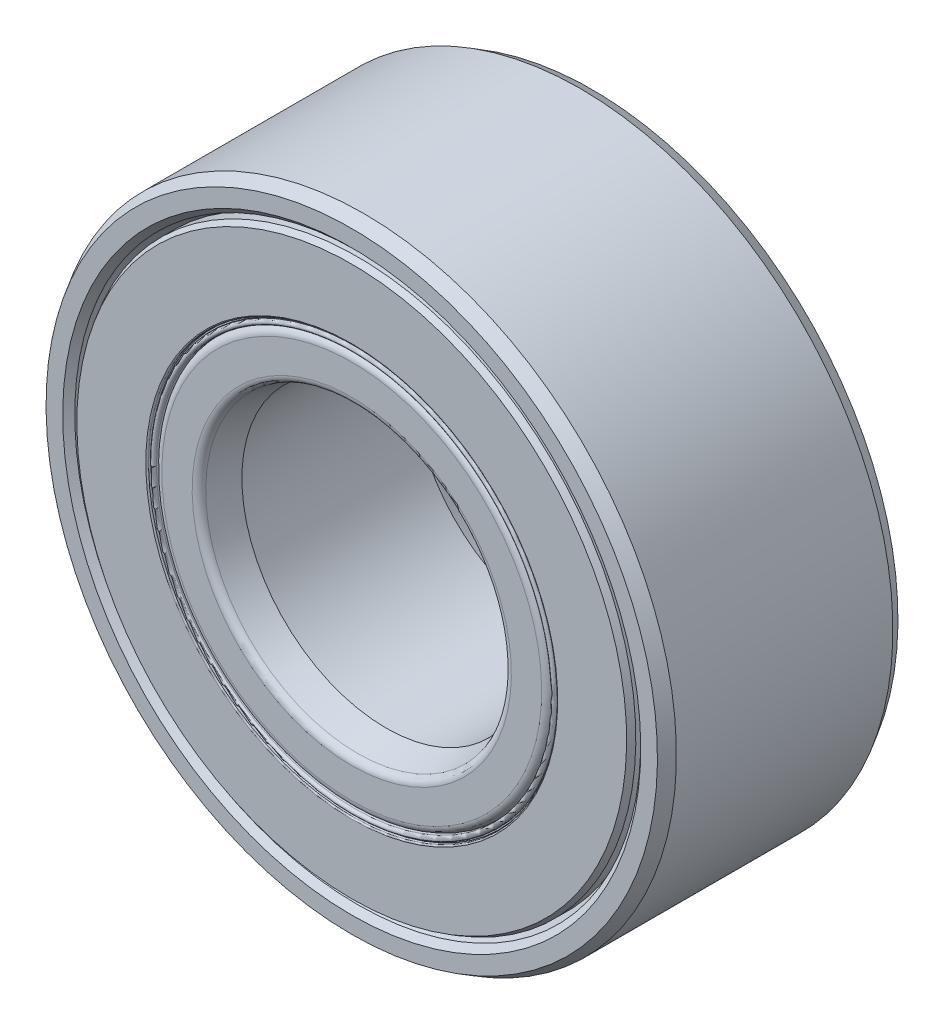
from build123d import *

# Parameters (mm, degrees)
CIRPATTERN1_COUNT = 9


with BuildPart() as part:
    # Sketch3 → Revolve1 (revolve)
    with BuildSketch(Plane(origin=(0, 0, 0), x_dir=(0, 0, -1), z_dir=(1, 0, 0)), mode=Mode.PRIVATE) as revolve1_sk:
        with BuildLine():
            Line((-2.103734106, 5.785), (-2.375, 5.883732711))
            Line((-2.375, 5.883732711), (-2.5, 6.008732711))
            Line((-2.5, 6.008732711), (-2.5, 6.355662433))
            Line((-2.5, 6.355662433), (-2.25, 6.5))
            Line((-2.25, 6.5), (2.25, 6.5))
            Line((2.25, 6.5), (2.5, 6.355662433))
            Line((2.5, 6.355662433), (2.5, 6.008732711))
            Line((2.5, 6.008732711), (2.375, 5.883732711))
            Line((2.375, 5.883732711), (2.103734106, 5.785))
            Line((2.103734106, 5.785), (1.011948066, 5.785))
            ThreePointArc((1.011948066, 5.785), (0, 6.261666667), (-1.011948066, 5.785))
            Line((-1.011948066, 5.785), (-2.103734106, 5.785))
        make_face()
    revolve(revolve1_sk.sketch.rotate(Axis((0, 0, 2.5), (0, 0, -1)), 180), axis=Axis((0, 0, 2.5), (0, 0, -1)))


with BuildPart() as body_2:
    # Sketch4 → Revolve2 (revolve)
    with BuildSketch(Plane(origin=(0, 0, 0), x_dir=(0, 0, -1), z_dir=(1, 0, 0)), mode=Mode.PRIVATE) as revolve2_sk:
        with BuildLine():
            Line((-1.783849034, 3), (-2.377867121, 3.159166667))
            ThreePointArc((-2.377867121, 3.159166667), (-2.465948462, 3.218020737), (-2.5, 3.318333333))
            Line((-2.5, 3.318333333), (-2.5, 3.948551875))
            ThreePointArc((-2.5, 3.948551875), (-2.451736628, 4.065069961), (-2.335218541, 4.113333333))
            Line((-2.335218541, 4.113333333), (-1.011948066, 4.113333333))
            ThreePointArc((-1.011948066, 4.113333333), (0, 3.636666667), (1.011948066, 4.113333333))
            Line((1.011948066, 4.113333333), (2.335218541, 4.113333333))
            ThreePointArc((2.335218541, 4.113333333), (2.451736628, 4.065069961), (2.5, 3.948551875))
            Line((2.5, 3.948551875), (2.5, 3.318333333))
            ThreePointArc((2.5, 3.318333333), (2.465948462, 3.218020737), (2.377867121, 3.159166667))
            Line((2.377867121, 3.159166667), (1.783849034, 3))
            Line((1.783849034, 3), (-1.783849034, 3))
        make_face()
    revolve(revolve2_sk.sketch.rotate(Axis((0, 0, 2.5), (0, 0, -1)), 180), axis=Axis((0, 0, 2.5), (0, 0, -1)))


with BuildPart() as body_3:
    # Sketch5 → Revolve3 (revolve)
    with BuildSketch(Plane(origin=(0, 0, 0), x_dir=(0, 0, -1), z_dir=(1, 0, 0))):
        with BuildLine():
            Line((-1.3125, 4.949166667), (1.3125, 4.949166667))
            ThreePointArc((1.3125, 4.949166667), (0, 6.261666667), (-1.3125, 4.949166667))
        make_face()
    revolve(axis=Axis((0, 4.949166667, 1.3125), (0, 0, -1)))


with BuildPart() as cirpattern1_1:
    # CirPattern1: pattern copy
    add(body_3.part.rotate(Axis((0, 0, 0), (0, 0, 1)), 1 * 360 / CIRPATTERN1_COUNT))


with BuildPart() as cirpattern1_2:
    # CirPattern1: pattern copy
    add(body_3.part.rotate(Axis((0, 0, 0), (0, 0, 1)), 2 * 360 / CIRPATTERN1_COUNT))


with BuildPart() as cirpattern1_3:
    # CirPattern1: pattern copy
    add(body_3.part.rotate(Axis((0, 0, 0), (0, 0, 1)), 3 * 360 / CIRPATTERN1_COUNT))


with BuildPart() as cirpattern1_4:
    # CirPattern1: pattern copy
    add(body_3.part.rotate(Axis((0, 0, 0), (0, 0, 1)), 4 * 360 / CIRPATTERN1_COUNT))


with BuildPart() as cirpattern1_5:
    # CirPattern1: pattern copy
    add(body_3.part.rotate(Axis((0, 0, 0), (0, 0, 1)), 5 * 360 / CIRPATTERN1_COUNT))


with BuildPart() as cirpattern1_6:
    # CirPattern1: pattern copy
    add(body_3.part.rotate(Axis((0, 0, 0), (0, 0, 1)), 6 * 360 / CIRPATTERN1_COUNT))


with BuildPart() as cirpattern1_7:
    # CirPattern1: pattern copy
    add(body_3.part.rotate(Axis((0, 0, 0), (0, 0, 1)), 7 * 360 / CIRPATTERN1_COUNT))


with BuildPart() as cirpattern1_8:
    # CirPattern1: pattern copy
    add(body_3.part.rotate(Axis((0, 0, 0), (0, 0, 1)), 8 * 360 / CIRPATTERN1_COUNT))


with BuildPart() as body_12:
    # Sketch6 → Revolve4 (revolve)
    with BuildSketch(Plane(origin=(0, 0, 0), x_dir=(0, 0, -1), z_dir=(1, 0, 0)), mode=Mode.PRIVATE) as revolve4_sk:
        with BuildLine():
            Line((-2.378756443, 5.785), (-1.3125, 5.785))
            Line((-1.3125, 5.785), (-1.3125, 4.253333333))
            Line((-1.3125, 4.253333333), (-2.472, 4.253333333))
            ThreePointArc((-2.472, 4.253333333), (-2.49179899, 4.261534343), (-2.5, 4.281333333))
            Line((-2.5, 4.281333333), (-2.5, 5.715))
            Line((-2.5, 5.715), (-2.378756443, 5.785))
        make_face()
        with BuildLine():
            Line((2.472, 4.253333333), (1.3125, 4.253333333))
            Line((1.3125, 4.253333333), (1.3125, 5.785))
            Line((1.3125, 5.785), (2.378756443, 5.785))
            Line((2.378756443, 5.785), (2.5, 5.715))
            Line((2.5, 5.715), (2.5, 4.281333333))
            ThreePointArc((2.5, 4.281333333), (2.49179899, 4.261534343), (2.472, 4.253333333))
        make_face()
    revolve(revolve4_sk.sketch.rotate(Axis((0, 0, 2.5), (0, 0, -1)), 180), axis=Axis((0, 0, 2.5), (0, 0, -1)))


with BuildPart() as body_13:
    # Sketch7 → Revolve5 (revolve)
    with BuildSketch(Plane(origin=(0, 0, 0), x_dir=(0, 0, -1), z_dir=(1, 0, 0)), mode=Mode.PRIVATE) as revolve5_sk:
        with BuildLine():
            Line((-1.3125, 4.253333333), (-2.390562103, 4.253333333))
            Line((-2.390562103, 4.253333333), (-2.425030375, 4.247255647))
            ThreePointArc((-2.425030375, 4.247255647), (-2.437016396, 4.23163516), (-2.4225, 4.218333333))
            Line((-2.4225, 4.218333333), (-2.4475, 4.218333333))
            ThreePointArc((-2.4475, 4.218333333), (-2.5, 4.165833333), (-2.4475, 4.113333333))
            Line((-2.4475, 4.113333333), (-1.3125, 4.113333333))
            Line((-1.3125, 4.113333333), (-1.3125, 4.253333333))
        make_face()
    revolve(revolve5_sk.sketch.rotate(Axis((0, 0, 2.5), (0, 0, -1)), 180), axis=Axis((0, 0, 2.5), (0, 0, -1)))


solid = Compound([part.part, body_2.part, body_3.part, cirpattern1_1.part, cirpattern1_2.part, cirpattern1_3.part, cirpattern1_4.part, cirpattern1_5.part, cirpattern1_6.part, cirpattern1_7.part, cirpattern1_8.part, body_12.part, body_13.part])
